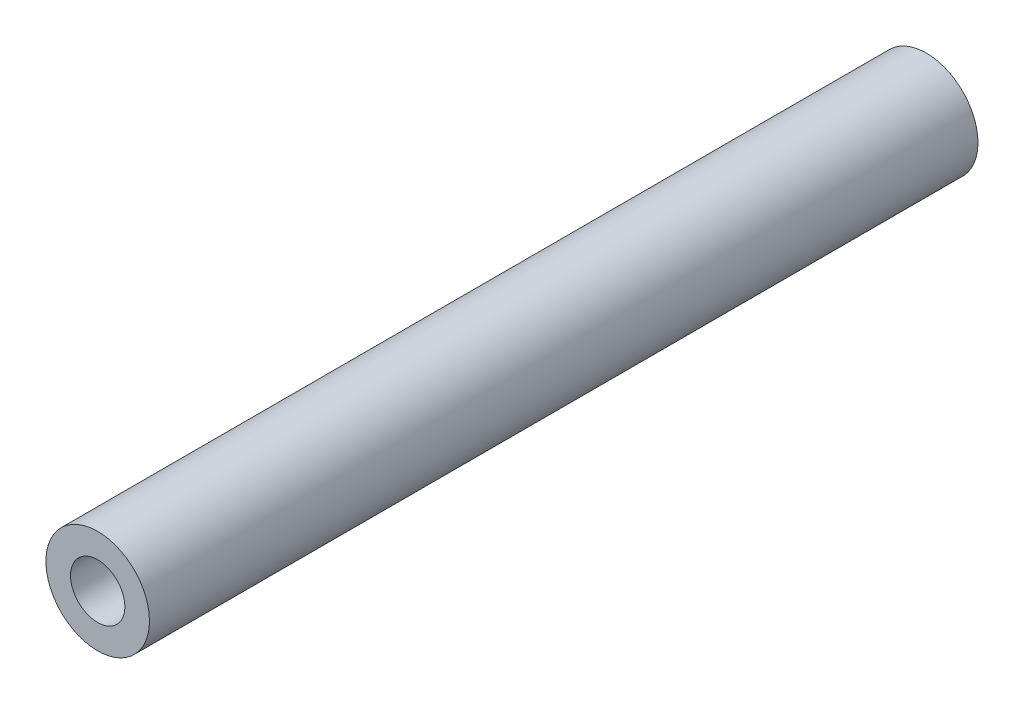
from build123d import *

# Parameters (mm, degrees)
ESQUISSE1_R        = 4
ESQUISSE1_R_2      = 2.1
BOSS_EXTRU_1_DEPTH = 64


with BuildPart() as part:
    # Esquisse1 → Boss.-Extru.1 (new body)
    with BuildSketch(Plane.XY):
        Circle(ESQUISSE1_R)
        Circle(ESQUISSE1_R_2, mode=Mode.SUBTRACT)
    extrude(amount=BOSS_EXTRU_1_DEPTH)


solid = part.part
